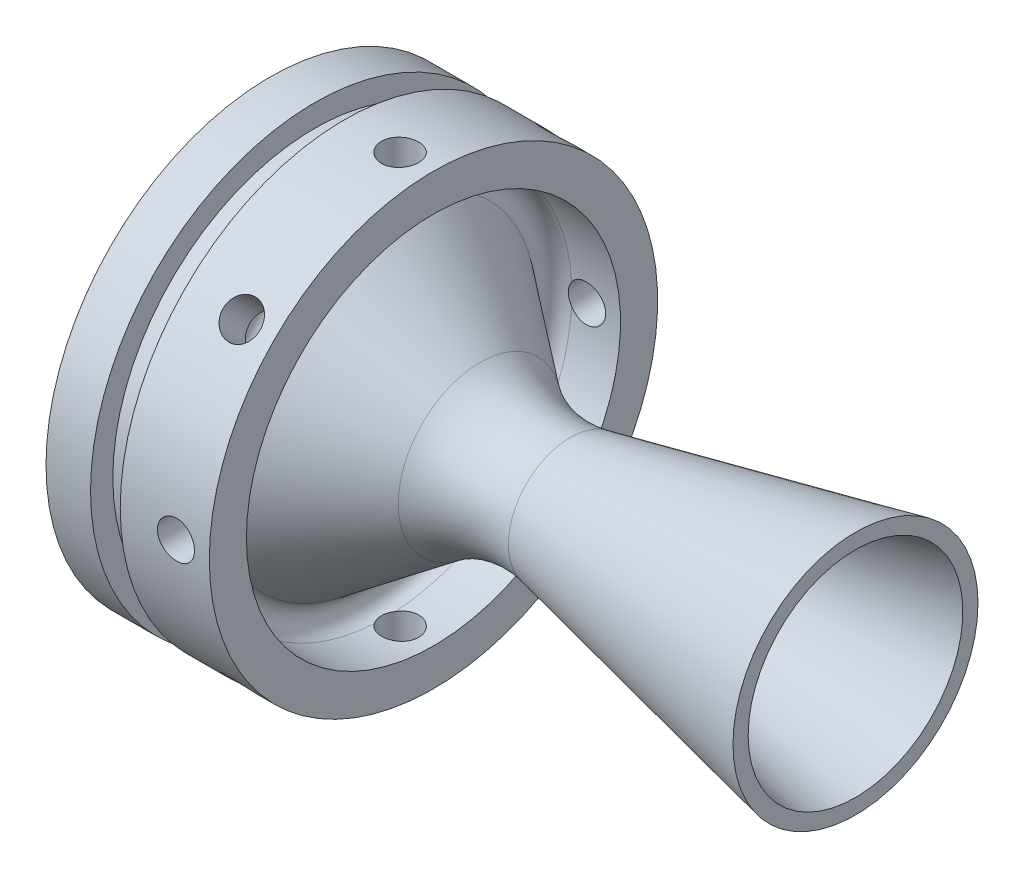
from build123d import *

# Parameters (mm, degrees)
SKETCH4_R          = 2.5
CUT_EXTRUDE2_DEPTH = 100
CIRPATTERN2_COUNT  = 8


with BuildPart() as part:
    # Sketch1 → Revolve1 (revolve)
    with BuildSketch(Plane.XY, mode=Mode.PRIVATE) as revolve1_sk:
        with BuildLine():
            Line((1.039558454, 4.829261996), (46.348618443, 14.46))
            Line((46.348618443, 14.46), (46.348618443, 16.50468119))
            Line((46.348618443, 16.50468119), (7.917033014, 8.335795532))
            ThreePointArc((7.917033014, 8.335795532), (1.551763443, 8.363569436), (-4.228867695, 11.028476892))
            Line((-4.228867695, 11.028476892), (-18.261374171, 21.60272898))
            ThreePointArc((-18.261374171, 21.60272898), (-18.954391435, 23.834609313), (-17.057744125, 25.2))
            Line((-17.057744125, 25.2), (-10.504922768, 25.2))
            Line((-10.504922768, 25.2), (-10.504922768, 30.2))
            Line((-10.504922768, 30.2), (-22.504922768, 30.2))
            Line((-22.504922768, 30.2), (-22.504922768, 27.2))
            Line((-22.504922768, 27.2), (-26.504922768, 27.2))
            Line((-26.504922768, 27.2), (-26.504922768, 30.2))
            Line((-26.504922768, 30.2), (-32.504922768, 30.2))
            Line((-32.504922768, 30.2), (-32.504922768, 27.95353791))
            Line((-32.504922768, 27.95353791), (-3.009075116, 5.72682245))
            ThreePointArc((-3.009075116, 5.72682245), (-1.08219807, 4.838519964), (1.039558454, 4.829261996))
        make_face()
    revolve(revolve1_sk.sketch.rotate(Axis((-34.362308285, 0, 0), (1, 0, 0)), 90), axis=Axis((-34.362308285, 0, 0), (1, 0, 0)))

    # Sketch4 → Cut-Extrude2 (cut)
    with BuildSketch(Plane(origin=(0, 22, 0), x_dir=(-1, 0, 0), z_dir=(0, 1, 0))):
        with Locations(Location((15, 0, 0), (0, 0, 270))):
            Circle(SKETCH4_R)
    cut_extrude2 = extrude(amount=CUT_EXTRUDE2_DEPTH, mode=Mode.SUBTRACT)

    # CirPattern2: Cut-Extrude2 ×8 about axis
    cirpattern2_axis = Axis((-42.896286604, 0, 0), (1, 0, 0))
    for i in range(1, CIRPATTERN2_COUNT):
        add(cut_extrude2.rotate(cirpattern2_axis, i * 360 / CIRPATTERN2_COUNT), mode=Mode.SUBTRACT)


solid = part.part
